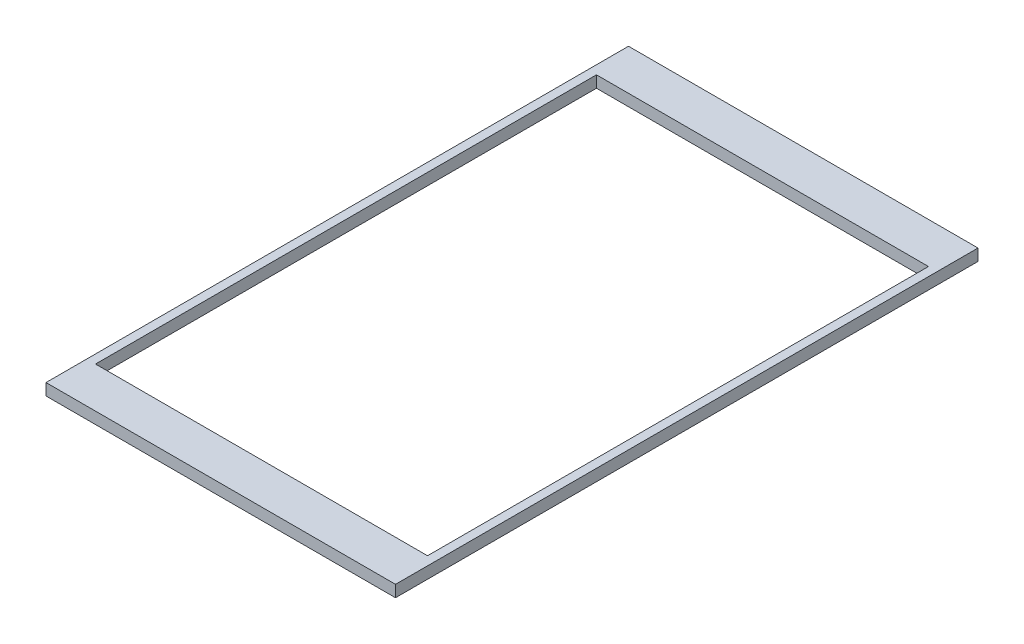
from build123d import *

# Parameters (mm, degrees)
SKETCH1_W               = 76.2
SKETCH1_H               = 127
BODY_DEPTH              = 2.54
SKETCH2_W               = 72.39
SKETCH2_H               = 109.22
CIRCUITBOARD_HOLE_DEPTH = 2.54


with BuildPart() as part:
    # Sketch1 → body (new body)
    with BuildSketch(Plane(origin=(0, 0, 0), x_dir=(1, 0, 0), z_dir=(0, 1, 0))):
        Rectangle(SKETCH1_W, SKETCH1_H)
    extrude(amount=BODY_DEPTH)

    # Sketch2 → circuitboard hole (cut)
    with BuildSketch(Plane(origin=(0, 2.54, 0), x_dir=(1, 0, 0), z_dir=(0, 1, 0))):
        Rectangle(SKETCH2_W, SKETCH2_H)
    extrude(amount=-CIRCUITBOARD_HOLE_DEPTH, mode=Mode.SUBTRACT)


solid = part.part
